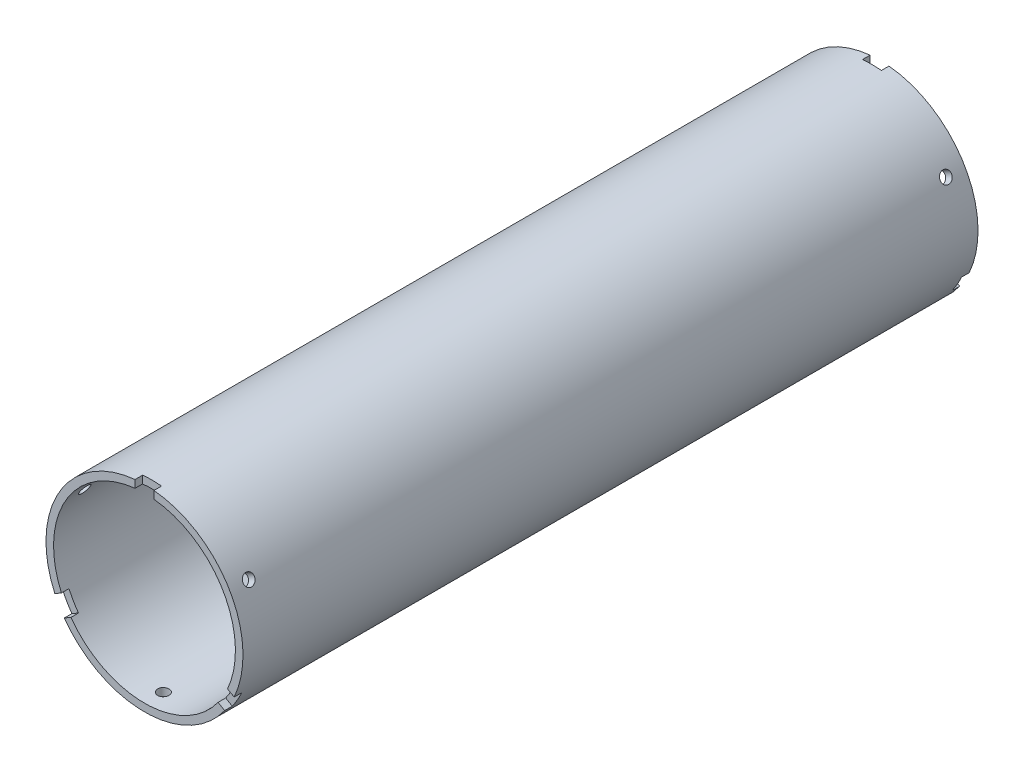
from build123d import *

# Parameters (mm, degrees)
SKETCH_1_R               = 26
SKETCH_1_R_2             = 24
EXTRUDE_1_DEPTH          = 194
SKETCH_2_R               = 1.5
CUT_EXTRUDE_1_DEPTH      = 88
PATTERN_CIRCULAR_1_COUNT = 3
SKETCH_3_W               = 5
SKETCH_3_H               = 11.473941433
CUT_EXTRUDE_2_DEPTH      = 2
PATTERN_CIRCULAR_2_COUNT = 3
SKETCH_4_W               = 5
SKETCH_4_H               = 11.473941433
CUT_EXTRUDE_3_DEPTH      = 2
PATTERN_CIRCULAR_3_COUNT = 3


with BuildPart() as part:
    # Эскиз1 → Бобышка-Вытянуть1 (new body)
    with BuildSketch(Plane.XY):
        with Locations(Location((0, 0, 0), (0, 0, 180))):
            Circle(SKETCH_1_R)
        with Locations(Location((0, 0, 0), (0, 0, 180))):
            Circle(SKETCH_1_R_2, mode=Mode.SUBTRACT)
    extrude(amount=EXTRUDE_1_DEPTH)

    # Эскиз2 → Вырез-Вытянуть1 (cut)
    with BuildSketch(Plane(origin=(0, 0, 0), x_dir=(1, 0, 0), z_dir=(0, 1, 0))):
        with Locations(Location((0, -5, 0), (0, 0, 270))):
            Circle(SKETCH_2_R)
        with Locations(Location((0, -189, 0), (0, 0, 270))):
            Circle(SKETCH_2_R)
    cut_extrude_1 = extrude(amount=-CUT_EXTRUDE_1_DEPTH, mode=Mode.SUBTRACT)

    # Круговой массив1: Вырез-Вытянуть1 ×3 about axis
    pattern_circular_1_axis = Axis((0, 0, 194), (0, 0, -1))
    for i in range(1, PATTERN_CIRCULAR_1_COUNT):
        add(cut_extrude_1.rotate(pattern_circular_1_axis, i * 360 / PATTERN_CIRCULAR_1_COUNT), mode=Mode.SUBTRACT)

    # Эскиз3 → Вырез-Вытянуть2 (cut)
    with BuildSketch(Plane(origin=(0, 0, 0), x_dir=(-1, 0, 0), z_dir=(0, 0, -1))):
        with Locations((0, 22.870937025)):
            Rectangle(SKETCH_3_W, SKETCH_3_H)
    cut_extrude_2 = extrude(amount=-CUT_EXTRUDE_2_DEPTH, mode=Mode.SUBTRACT)

    # Круговой массив2: Вырез-Вытянуть2 ×3 about axis
    pattern_circular_2_axis = Axis((0, 0, 0), (0, 0, 1))
    for i in range(1, PATTERN_CIRCULAR_2_COUNT):
        add(cut_extrude_2.rotate(pattern_circular_2_axis, i * 360 / PATTERN_CIRCULAR_2_COUNT), mode=Mode.SUBTRACT)

    # Эскиз4 → Вырез-Вытянуть3 (cut)
    with BuildSketch(Plane.XY.offset(194)):
        with Locations((0, 22.870937025)):
            Rectangle(SKETCH_4_W, SKETCH_4_H)
    cut_extrude_3 = extrude(amount=-CUT_EXTRUDE_3_DEPTH, mode=Mode.SUBTRACT)

    # Круговой массив3: Вырез-Вытянуть3 ×3 about axis
    pattern_circular_3_axis = Axis((0, 0, 0), (0, 0, 1))
    for i in range(1, PATTERN_CIRCULAR_3_COUNT):
        add(cut_extrude_3.rotate(pattern_circular_3_axis, i * 360 / PATTERN_CIRCULAR_3_COUNT), mode=Mode.SUBTRACT)


solid = part.part
